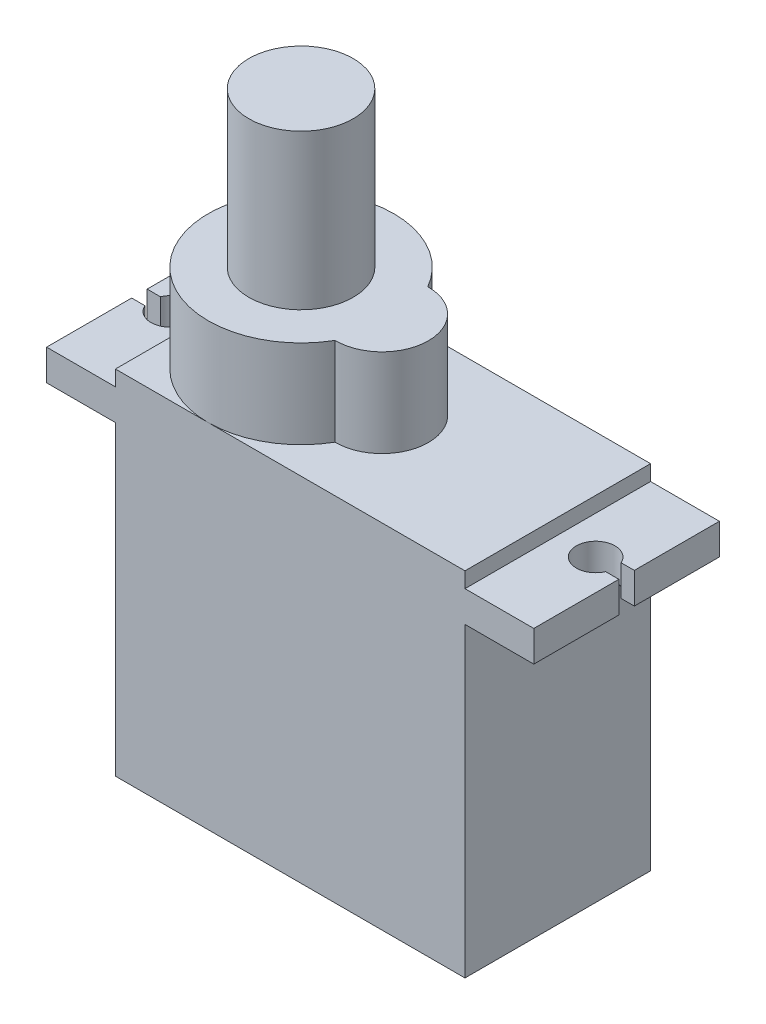
from build123d import *

# Parameters (mm, degrees)
SCHIZZO1_W                   = 22.6
SCHIZZO1_H                   = 12
ESTRUSIONE_ESTRUSIONE1_DEPTH = 19.8
SCHIZZO3_W                   = 31.5
SCHIZZO3_H                   = 12
ESTRUSIONE_ESTRUSIONE2_DEPTH = 2
SCHIZZO4_W                   = 22.6
SCHIZZO4_H                   = 12
ESTRUSIONE_ESTRUSIONE3_DEPTH = 1
SCHIZZO5_R                   = 3
SCHIZZO5_R_2                 = 6
ESTRUSIONE_ESTRUSIONE4_DEPTH = 5.7
SCHIZZO6_R                   = 3.375
ESTRUSIONE_ESTRUSIONE5_DEPTH = 10
TAGLIO_ESTRUSIONE2_REACH     = 38.755


with BuildPart() as part:
    # Schizzo1 → Estrusione-Estrusione1 (new body)
    with BuildSketch(Plane(origin=(0, 0, 0), x_dir=(1, 0, 0), z_dir=(0, 1, 0))):
        with Locations((11.3, 6)):
            Rectangle(SCHIZZO1_W, SCHIZZO1_H)
    extrude(amount=ESTRUSIONE_ESTRUSIONE1_DEPTH)

    # Schizzo3 → Estrusione-Estrusione2 (add)
    with BuildSketch(Plane(origin=(0, 19.8, 0), x_dir=(1, 0, 0), z_dir=(0, 1, 0))):
        with Locations((11.3, 6)):
            Rectangle(SCHIZZO3_W, SCHIZZO3_H)
    extrude(amount=ESTRUSIONE_ESTRUSIONE2_DEPTH)

    # Schizzo4 → Estrusione-Estrusione3 (add)
    with BuildSketch(Plane(origin=(0, 21.8, 0), x_dir=(1, 0, 0), z_dir=(0, 1, 0))):
        with Locations((11.3, 6)):
            Rectangle(SCHIZZO4_W, SCHIZZO4_H)
    extrude(amount=ESTRUSIONE_ESTRUSIONE3_DEPTH)

    # Schizzo5 → Estrusione-Estrusione4 (add)
    with BuildSketch(Plane(origin=(0, 22.8, 0), x_dir=(1, 0, 0), z_dir=(0, 1, 0))):
        with Locations((11.236395356, 6)):
            Circle(SCHIZZO5_R)
        with Locations((6, 6)):
            Circle(SCHIZZO5_R_2)
    extrude(amount=ESTRUSIONE_ESTRUSIONE4_DEPTH)

    # Schizzo6 → Estrusione-Estrusione5 (add)
    with BuildSketch(Plane(origin=(0, 28.5, 0), x_dir=(1, 0, 0), z_dir=(0, 1, 0))):
        with Locations(Location((6, 6, 0), (0, 0, 270))):
            Circle(SCHIZZO6_R)
    extrude(amount=ESTRUSIONE_ESTRUSIONE5_DEPTH)

    # Schizzo7 → Taglio-Estrusione2 (cut, up to next)
    with BuildSketch(Plane(origin=(0, 21.8, 0), x_dir=(1, 0, 0), z_dir=(0, 1, 0)), mode=Mode.PRIVATE) as taglio_estrusione2_sk1:
        with BuildLine():
            Line((-4.45, 5.5), (-3.595643924, 5.5))
            ThreePointArc((-3.595643924, 5.5), (-3.673632891, 5.744612945), (-3.7, 6))
            Line((-3.7, 6), (-4.45, 6))
            Line((-4.45, 6), (-4.45, 5.5))
        make_face()
    taglio_estrusione2_tool1 = extrude(taglio_estrusione2_sk1.sketch, amount=-TAGLIO_ESTRUSIONE2_REACH, mode=Mode.PRIVATE) & part.part
    # Schizzo7 → Taglio-Estrusione2 (cut, up to next)
    with BuildSketch(Plane(origin=(0, 21.8, 0), x_dir=(1, 0, 0), z_dir=(0, 1, 0)), mode=Mode.PRIVATE) as taglio_estrusione2_sk2:
        with BuildLine():
            ThreePointArc((-3.7, 6), (-3.673632891, 6.255387055), (-3.595643924, 6.5))
            Line((-3.595643924, 6.5), (-4.45, 6.5))
            Line((-4.45, 6.5), (-4.45, 6))
            Line((-4.45, 6), (-3.7, 6))
        make_face()
    taglio_estrusione2_tool2 = extrude(taglio_estrusione2_sk2.sketch, amount=-TAGLIO_ESTRUSIONE2_REACH, mode=Mode.PRIVATE) & part.part
    # Schizzo7 → Taglio-Estrusione2 (cut, up to next)
    with BuildSketch(Plane(origin=(0, 21.8, 0), x_dir=(1, 0, 0), z_dir=(0, 1, 0)), mode=Mode.PRIVATE) as taglio_estrusione2_sk3:
        with BuildLine():
            ThreePointArc((-3.595643924, 5.5), (-2.194612945, 4.776367109), (-1.2, 6))
            Line((-1.2, 6), (-2.449082486, 6))
            Line((-2.449082486, 6), (-2.449082486, 5.5))
            Line((-2.449082486, 5.5), (-3.595643924, 5.5))
        make_face()
    taglio_estrusione2_tool3 = extrude(taglio_estrusione2_sk3.sketch, amount=-TAGLIO_ESTRUSIONE2_REACH, mode=Mode.PRIVATE) & part.part
    # Schizzo7 → Taglio-Estrusione2 (cut, up to next)
    with BuildSketch(Plane(origin=(0, 21.8, 0), x_dir=(1, 0, 0), z_dir=(0, 1, 0)), mode=Mode.PRIVATE) as taglio_estrusione2_sk4:
        with BuildLine():
            Line((-2.449082486, 5.5), (-2.449082486, 6))
            Line((-2.449082486, 6), (-3.7, 6))
            ThreePointArc((-3.7, 6), (-3.673632891, 5.744612945), (-3.595643924, 5.5))
            Line((-3.595643924, 5.5), (-2.449082486, 5.5))
        make_face()
    taglio_estrusione2_tool4 = extrude(taglio_estrusione2_sk4.sketch, amount=-TAGLIO_ESTRUSIONE2_REACH, mode=Mode.PRIVATE) & part.part
    # Schizzo7 → Taglio-Estrusione2 (cut, up to next)
    with BuildSketch(Plane(origin=(0, 21.8, 0), x_dir=(1, 0, 0), z_dir=(0, 1, 0)), mode=Mode.PRIVATE) as taglio_estrusione2_sk5:
        with BuildLine():
            Line((-2.449082486, 6), (-1.2, 6))
            ThreePointArc((-1.2, 6), (-2.194612945, 7.223632891), (-3.595643924, 6.5))
            Line((-3.595643924, 6.5), (-2.449082486, 6.5))
            Line((-2.449082486, 6.5), (-2.449082486, 6))
        make_face()
    taglio_estrusione2_tool5 = extrude(taglio_estrusione2_sk5.sketch, amount=-TAGLIO_ESTRUSIONE2_REACH, mode=Mode.PRIVATE) & part.part
    # Schizzo7 → Taglio-Estrusione2 (cut, up to next)
    with BuildSketch(Plane(origin=(0, 21.8, 0), x_dir=(1, 0, 0), z_dir=(0, 1, 0)), mode=Mode.PRIVATE) as taglio_estrusione2_sk6:
        with BuildLine():
            Line((-3.7, 6), (-2.449082486, 6))
            Line((-2.449082486, 6), (-2.449082486, 6.5))
            Line((-2.449082486, 6.5), (-3.595643924, 6.5))
            ThreePointArc((-3.595643924, 6.5), (-3.673632891, 6.255387055), (-3.7, 6))
        make_face()
    taglio_estrusione2_tool6 = extrude(taglio_estrusione2_sk6.sketch, amount=-TAGLIO_ESTRUSIONE2_REACH, mode=Mode.PRIVATE) & part.part
    # Schizzo7 → Taglio-Estrusione2 (cut, up to next)
    with BuildSketch(Plane(origin=(0, 21.8, 0), x_dir=(1, 0, 0), z_dir=(0, 1, 0)), mode=Mode.PRIVATE) as taglio_estrusione2_sk7:
        with BuildLine():
            ThreePointArc((-3.595643924, 5.5), (-2.194612945, 4.776367109), (-1.2, 6))
            Line((-1.2, 6), (-2.449082486, 6))
            Line((-2.449082486, 6), (-2.449082486, 5.5))
            Line((-2.449082486, 5.5), (-3.595643924, 5.5))
        make_face()
    taglio_estrusione2_tool7 = extrude(taglio_estrusione2_sk7.sketch, amount=-TAGLIO_ESTRUSIONE2_REACH, mode=Mode.PRIVATE) & part.part
    # Schizzo7 → Taglio-Estrusione2 (cut, up to next)
    with BuildSketch(Plane(origin=(0, 21.8, 0), x_dir=(1, 0, 0), z_dir=(0, 1, 0)), mode=Mode.PRIVATE) as taglio_estrusione2_sk8:
        with BuildLine():
            Line((-2.449082486, 5.5), (-2.449082486, 6))
            Line((-2.449082486, 6), (-3.7, 6))
            ThreePointArc((-3.7, 6), (-3.673632891, 5.744612945), (-3.595643924, 5.5))
            Line((-3.595643924, 5.5), (-2.449082486, 5.5))
        make_face()
    taglio_estrusione2_tool8 = extrude(taglio_estrusione2_sk8.sketch, amount=-TAGLIO_ESTRUSIONE2_REACH, mode=Mode.PRIVATE) & part.part
    # Schizzo7 → Taglio-Estrusione2 (cut, up to next)
    with BuildSketch(Plane(origin=(0, 21.8, 0), x_dir=(1, 0, 0), z_dir=(0, 1, 0)), mode=Mode.PRIVATE) as taglio_estrusione2_sk9:
        with BuildLine():
            Line((-2.449082486, 6), (-1.2, 6))
            ThreePointArc((-1.2, 6), (-2.194612945, 7.223632891), (-3.595643924, 6.5))
            Line((-3.595643924, 6.5), (-2.449082486, 6.5))
            Line((-2.449082486, 6.5), (-2.449082486, 6))
        make_face()
    taglio_estrusione2_tool9 = extrude(taglio_estrusione2_sk9.sketch, amount=-TAGLIO_ESTRUSIONE2_REACH, mode=Mode.PRIVATE) & part.part
    # Schizzo7 → Taglio-Estrusione2 (cut, up to next)
    with BuildSketch(Plane(origin=(0, 21.8, 0), x_dir=(1, 0, 0), z_dir=(0, 1, 0)), mode=Mode.PRIVATE) as taglio_estrusione2_sk10:
        with BuildLine():
            Line((-3.7, 6), (-2.449082486, 6))
            Line((-2.449082486, 6), (-2.449082486, 6.5))
            Line((-2.449082486, 6.5), (-3.595643924, 6.5))
            ThreePointArc((-3.595643924, 6.5), (-3.673632891, 6.255387055), (-3.7, 6))
        make_face()
    taglio_estrusione2_tool10 = extrude(taglio_estrusione2_sk10.sketch, amount=-TAGLIO_ESTRUSIONE2_REACH, mode=Mode.PRIVATE) & part.part
    # Schizzo7 → Taglio-Estrusione2 (cut, up to next)
    with BuildSketch(Plane(origin=(0, 21.8, 0), x_dir=(1, 0, 0), z_dir=(0, 1, 0)), mode=Mode.PRIVATE) as taglio_estrusione2_sk11:
        with BuildLine():
            ThreePointArc((26.195643924, 5.5), (26.273632891, 5.744612945), (26.3, 6))
            Line((26.3, 6), (25.047557224, 6))
            Line((25.047557224, 6), (25.047557224, 5.5))
            Line((25.047557224, 5.5), (26.195643924, 5.5))
        make_face()
    taglio_estrusione2_tool11 = extrude(taglio_estrusione2_sk11.sketch, amount=-TAGLIO_ESTRUSIONE2_REACH, mode=Mode.PRIVATE) & part.part
    # Schizzo7 → Taglio-Estrusione2 (cut, up to next)
    with BuildSketch(Plane(origin=(0, 21.8, 0), x_dir=(1, 0, 0), z_dir=(0, 1, 0)), mode=Mode.PRIVATE) as taglio_estrusione2_sk12:
        with BuildLine():
            Line((25.047557224, 5.5), (25.047557224, 6))
            Line((25.047557224, 6), (23.8, 6))
            ThreePointArc((23.8, 6), (24.794612945, 4.776367109), (26.195643924, 5.5))
            Line((26.195643924, 5.5), (25.047557224, 5.5))
        make_face()
    taglio_estrusione2_tool12 = extrude(taglio_estrusione2_sk12.sketch, amount=-TAGLIO_ESTRUSIONE2_REACH, mode=Mode.PRIVATE) & part.part
    # Schizzo7 → Taglio-Estrusione2 (cut, up to next)
    with BuildSketch(Plane(origin=(0, 21.8, 0), x_dir=(1, 0, 0), z_dir=(0, 1, 0)), mode=Mode.PRIVATE) as taglio_estrusione2_sk13:
        with BuildLine():
            ThreePointArc((26.195643924, 5.5), (26.273632891, 5.744612945), (26.3, 6))
            Line((26.3, 6), (25.047557224, 6))
            Line((25.047557224, 6), (25.047557224, 5.5))
            Line((25.047557224, 5.5), (26.195643924, 5.5))
        make_face()
    taglio_estrusione2_tool13 = extrude(taglio_estrusione2_sk13.sketch, amount=-TAGLIO_ESTRUSIONE2_REACH, mode=Mode.PRIVATE) & part.part
    # Schizzo7 → Taglio-Estrusione2 (cut, up to next)
    with BuildSketch(Plane(origin=(0, 21.8, 0), x_dir=(1, 0, 0), z_dir=(0, 1, 0)), mode=Mode.PRIVATE) as taglio_estrusione2_sk14:
        with BuildLine():
            Line((25.047557224, 5.5), (25.047557224, 6))
            Line((25.047557224, 6), (23.8, 6))
            ThreePointArc((23.8, 6), (24.794612945, 4.776367109), (26.195643924, 5.5))
            Line((26.195643924, 5.5), (25.047557224, 5.5))
        make_face()
    taglio_estrusione2_tool14 = extrude(taglio_estrusione2_sk14.sketch, amount=-TAGLIO_ESTRUSIONE2_REACH, mode=Mode.PRIVATE) & part.part
    # Schizzo7 → Taglio-Estrusione2 (cut, up to next)
    with BuildSketch(Plane(origin=(0, 21.8, 0), x_dir=(1, 0, 0), z_dir=(0, 1, 0)), mode=Mode.PRIVATE) as taglio_estrusione2_sk15:
        with BuildLine():
            Line((25.047557224, 6), (26.3, 6))
            ThreePointArc((26.3, 6), (26.273632891, 6.255387055), (26.195643924, 6.5))
            Line((26.195643924, 6.5), (25.047557224, 6.5))
            Line((25.047557224, 6.5), (25.047557224, 6))
        make_face()
    taglio_estrusione2_tool15 = extrude(taglio_estrusione2_sk15.sketch, amount=-TAGLIO_ESTRUSIONE2_REACH, mode=Mode.PRIVATE) & part.part
    # Schizzo7 → Taglio-Estrusione2 (cut, up to next)
    with BuildSketch(Plane(origin=(0, 21.8, 0), x_dir=(1, 0, 0), z_dir=(0, 1, 0)), mode=Mode.PRIVATE) as taglio_estrusione2_sk16:
        with BuildLine():
            Line((23.8, 6), (25.047557224, 6))
            Line((25.047557224, 6), (25.047557224, 6.5))
            Line((25.047557224, 6.5), (26.195643924, 6.5))
            ThreePointArc((26.195643924, 6.5), (24.794612945, 7.223632891), (23.8, 6))
        make_face()
    taglio_estrusione2_tool16 = extrude(taglio_estrusione2_sk16.sketch, amount=-TAGLIO_ESTRUSIONE2_REACH, mode=Mode.PRIVATE) & part.part
    # Schizzo7 → Taglio-Estrusione2 (cut, up to next)
    with BuildSketch(Plane(origin=(0, 21.8, 0), x_dir=(1, 0, 0), z_dir=(0, 1, 0)), mode=Mode.PRIVATE) as taglio_estrusione2_sk17:
        with BuildLine():
            Line((25.047557224, 6), (26.3, 6))
            ThreePointArc((26.3, 6), (26.273632891, 6.255387055), (26.195643924, 6.5))
            Line((26.195643924, 6.5), (25.047557224, 6.5))
            Line((25.047557224, 6.5), (25.047557224, 6))
        make_face()
    taglio_estrusione2_tool17 = extrude(taglio_estrusione2_sk17.sketch, amount=-TAGLIO_ESTRUSIONE2_REACH, mode=Mode.PRIVATE) & part.part
    # Schizzo7 → Taglio-Estrusione2 (cut, up to next)
    with BuildSketch(Plane(origin=(0, 21.8, 0), x_dir=(1, 0, 0), z_dir=(0, 1, 0)), mode=Mode.PRIVATE) as taglio_estrusione2_sk18:
        with BuildLine():
            Line((23.8, 6), (25.047557224, 6))
            Line((25.047557224, 6), (25.047557224, 6.5))
            Line((25.047557224, 6.5), (26.195643924, 6.5))
            ThreePointArc((26.195643924, 6.5), (24.794612945, 7.223632891), (23.8, 6))
        make_face()
    taglio_estrusione2_tool18 = extrude(taglio_estrusione2_sk18.sketch, amount=-TAGLIO_ESTRUSIONE2_REACH, mode=Mode.PRIVATE) & part.part
    # Schizzo7 → Taglio-Estrusione2 (cut, up to next)
    with BuildSketch(Plane(origin=(0, 21.8, 0), x_dir=(1, 0, 0), z_dir=(0, 1, 0)), mode=Mode.PRIVATE) as taglio_estrusione2_sk19:
        with BuildLine():
            Line((26.3, 6), (27.05, 6))
            Line((27.05, 6), (27.05, 6.5))
            Line((27.05, 6.5), (26.195643924, 6.5))
            ThreePointArc((26.195643924, 6.5), (26.273632891, 6.255387055), (26.3, 6))
        make_face()
    taglio_estrusione2_tool19 = extrude(taglio_estrusione2_sk19.sketch, amount=-TAGLIO_ESTRUSIONE2_REACH, mode=Mode.PRIVATE) & part.part
    # Schizzo7 → Taglio-Estrusione2 (cut, up to next)
    with BuildSketch(Plane(origin=(0, 21.8, 0), x_dir=(1, 0, 0), z_dir=(0, 1, 0)), mode=Mode.PRIVATE) as taglio_estrusione2_sk20:
        with BuildLine():
            Line((27.05, 5.5), (27.05, 6))
            Line((27.05, 6), (26.3, 6))
            ThreePointArc((26.3, 6), (26.273632891, 5.744612945), (26.195643924, 5.5))
            Line((26.195643924, 5.5), (27.05, 5.5))
        make_face()
    taglio_estrusione2_tool20 = extrude(taglio_estrusione2_sk20.sketch, amount=-TAGLIO_ESTRUSIONE2_REACH, mode=Mode.PRIVATE) & part.part
    add(taglio_estrusione2_tool1.solids().sort_by_distance((-4.057299, 21.8, -5.744505))[0], mode=Mode.SUBTRACT)
    add(taglio_estrusione2_tool2.solids().sort_by_distance((-4.057299, 21.8, -6.255495))[0], mode=Mode.SUBTRACT)
    add(taglio_estrusione2_tool3.solids().sort_by_distance((-2.24968, 21.8, -5.375869))[0], mode=Mode.SUBTRACT)
    add(taglio_estrusione2_tool4.solids().sort_by_distance((-3.057842, 21.8, -5.753542))[0], mode=Mode.SUBTRACT)
    add(taglio_estrusione2_tool5.solids().sort_by_distance((-2.24968, 21.8, -6.624131))[0], mode=Mode.SUBTRACT)
    add(taglio_estrusione2_tool6.solids().sort_by_distance((-3.057842, 21.8, -6.246458))[0], mode=Mode.SUBTRACT)
    add(taglio_estrusione2_tool7.solids().sort_by_distance((-2.24968, 21.8, -5.375869))[0], mode=Mode.SUBTRACT)
    add(taglio_estrusione2_tool8.solids().sort_by_distance((-3.057842, 21.8, -5.753542))[0], mode=Mode.SUBTRACT)
    add(taglio_estrusione2_tool9.solids().sort_by_distance((-2.24968, 21.8, -6.624131))[0], mode=Mode.SUBTRACT)
    add(taglio_estrusione2_tool10.solids().sort_by_distance((-3.057842, 21.8, -6.246458))[0], mode=Mode.SUBTRACT)
    add(taglio_estrusione2_tool11.solids().sort_by_distance((25.657079, 21.8, -5.753537))[0], mode=Mode.SUBTRACT)
    add(taglio_estrusione2_tool12.solids().sort_by_distance((24.849598, 21.8, -5.375715))[0], mode=Mode.SUBTRACT)
    add(taglio_estrusione2_tool13.solids().sort_by_distance((25.657079, 21.8, -5.753537))[0], mode=Mode.SUBTRACT)
    add(taglio_estrusione2_tool14.solids().sort_by_distance((24.849598, 21.8, -5.375715))[0], mode=Mode.SUBTRACT)
    add(taglio_estrusione2_tool15.solids().sort_by_distance((25.657079, 21.8, -6.246463))[0], mode=Mode.SUBTRACT)
    add(taglio_estrusione2_tool16.solids().sort_by_distance((24.849598, 21.8, -6.624285))[0], mode=Mode.SUBTRACT)
    add(taglio_estrusione2_tool17.solids().sort_by_distance((25.657079, 21.8, -6.246463))[0], mode=Mode.SUBTRACT)
    add(taglio_estrusione2_tool18.solids().sort_by_distance((24.849598, 21.8, -6.624285))[0], mode=Mode.SUBTRACT)
    add(taglio_estrusione2_tool19.solids().sort_by_distance((26.657299, 21.8, -6.255495))[0], mode=Mode.SUBTRACT)
    add(taglio_estrusione2_tool20.solids().sort_by_distance((26.657299, 21.8, -5.744505))[0], mode=Mode.SUBTRACT)


solid = part.part
